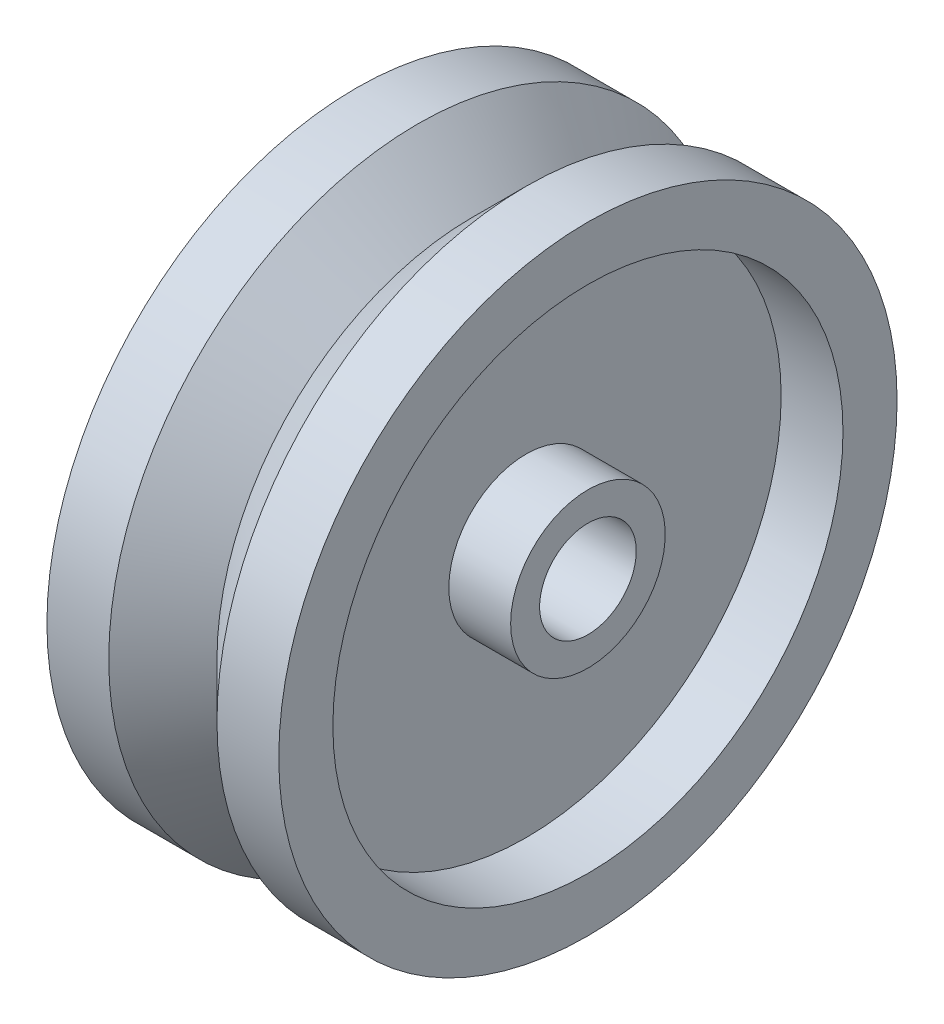
from build123d import *

# Parameters (mm, degrees)
SKETCH1_R           = 20
SKETCH1_R_2         = 3.125
BOSS_EXTRUDE1_DEPTH = 7.5
CUT_EXTRUDE1_START  = -4
SKETCH2_R           = 16.5
SKETCH2_R_2         = 5
CUT_EXTRUDE1_DEPTH  = 37.015621187


with BuildPart() as part:
    # Sketch1 → Boss-Extrude1 (new, symmetric)
    with BuildSketch(Plane(origin=(0, 0, 0), x_dir=(0, 0, -1), z_dir=(1, 0, 0))):
        Circle(SKETCH1_R)
        Circle(SKETCH1_R_2, mode=Mode.SUBTRACT)
    extrude(amount=BOSS_EXTRUDE1_DEPTH, both=True)

    # Sketch2 → Cut-Extrude1 (cut)
    with BuildSketch(Plane(origin=(7.5, 0, 0), x_dir=(0, 0, -1), z_dir=(1, 0, 0)).offset(CUT_EXTRUDE1_START)):
        with Locations(Location((0, 0, 0), (0, 0, 180))):
            Circle(SKETCH2_R)
        with Locations(Location((0, 0, 0), (0, 0, 180))):
            Circle(SKETCH2_R_2, mode=Mode.SUBTRACT)
    cut_extrude1 = extrude(amount=CUT_EXTRUDE1_DEPTH, mode=Mode.SUBTRACT)

    # Mirror1: Cut-Extrude1 across plane
    add(cut_extrude1.mirror(Plane(origin=(0, 0, 0), x_dir=(0, 0, 1), z_dir=(1, 0, 0))), mode=Mode.SUBTRACT)

    # Sketch3 → Cut-Revolve2 (revolve, cut)
    with BuildSketch(Plane.XY, mode=Mode.PRIVATE) as cut_revolve2_sk:
        Polygon((-3.5, 20), (0, 16.5), (3.5, 20), align=None)
    revolve(cut_revolve2_sk.sketch.rotate(Axis((0, 0, 0), (1, 0, 0)), 90), axis=Axis((0, 0, 0), (1, 0, 0)), mode=Mode.SUBTRACT)


solid = part.part
